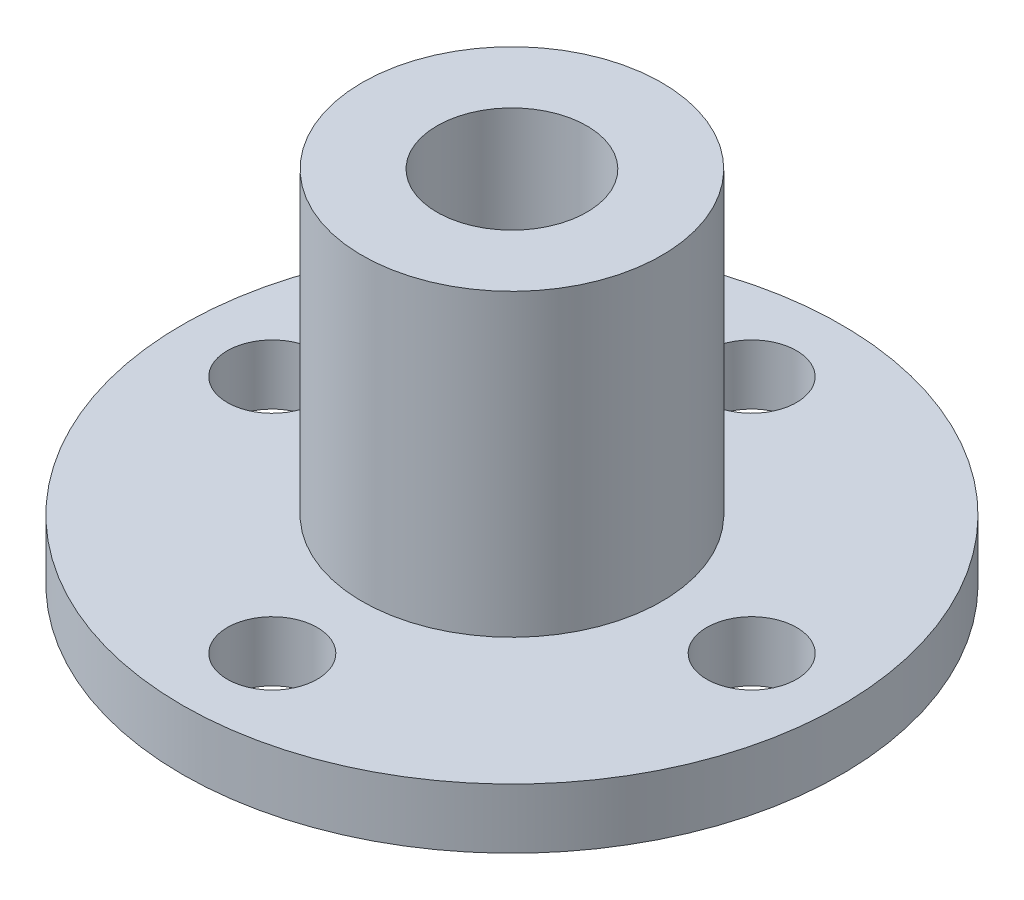
from build123d import *

# Parameters (mm, degrees)
SKETCH_1_R          = 11
EXTRUDE_1_DEPTH     = 2
SKETCH_2_R          = 5
EXTRUDE_2_DEPTH     = 10
SKETCH_3_R          = 1.5
CUT_EXTRUDE_1_DEPTH = 10
SKETCH_5_R          = 2.5
CUT_EXTRUDE_2_DEPTH = 20.646882704


with BuildPart() as part:
    # 草图1 → 凸台-拉伸1 (new body)
    with BuildSketch(Plane(origin=(0, 0, 0), x_dir=(0, 0, -1), z_dir=(0, 1, 0))):
        with Locations(Location((0, 0, 0), (0, 0, 180))):
            Circle(SKETCH_1_R)
    extrude(amount=EXTRUDE_1_DEPTH)

    # 草图2 → 凸台-拉伸2 (add)
    with BuildSketch(Plane(origin=(0, 2, 0), x_dir=(0, 0, -1), z_dir=(0, 1, 0))):
        with Locations(Location((0, 0, 0), (0, 0, 90))):
            Circle(SKETCH_2_R)
    extrude(amount=EXTRUDE_2_DEPTH)

    # 草图3 → 切除-拉伸1 (cut)
    with BuildSketch(Plane(origin=(0, 2, 0), x_dir=(0, 0, -1), z_dir=(0, 1, 0))):
        with Locations(Location((0, 8, 0), (0, 0, 90))):
            Circle(SKETCH_3_R)
        with Locations(Location((8.001, 0.001, 0), (0, 0, 90))):
            Circle(SKETCH_3_R)
        with Locations(Location((0.002, -8, 0), (0, 0, 90))):
            Circle(SKETCH_3_R)
        with Locations(Location((-7.999, -0.001, 0), (0, 0, 90))):
            Circle(SKETCH_3_R)
    extrude(amount=-CUT_EXTRUDE_1_DEPTH, mode=Mode.SUBTRACT)

    # 草图5 → 切除-拉伸2 (cut, through all)
    with BuildSketch(Plane(origin=(0, 12, 0), x_dir=(1, 0, 0), z_dir=(0, 1, 0))):
        with Locations(Location((0, 0, 0), (0, 0, 180))):
            Circle(SKETCH_5_R)
    extrude(amount=-CUT_EXTRUDE_2_DEPTH, mode=Mode.SUBTRACT)


solid = part.part
